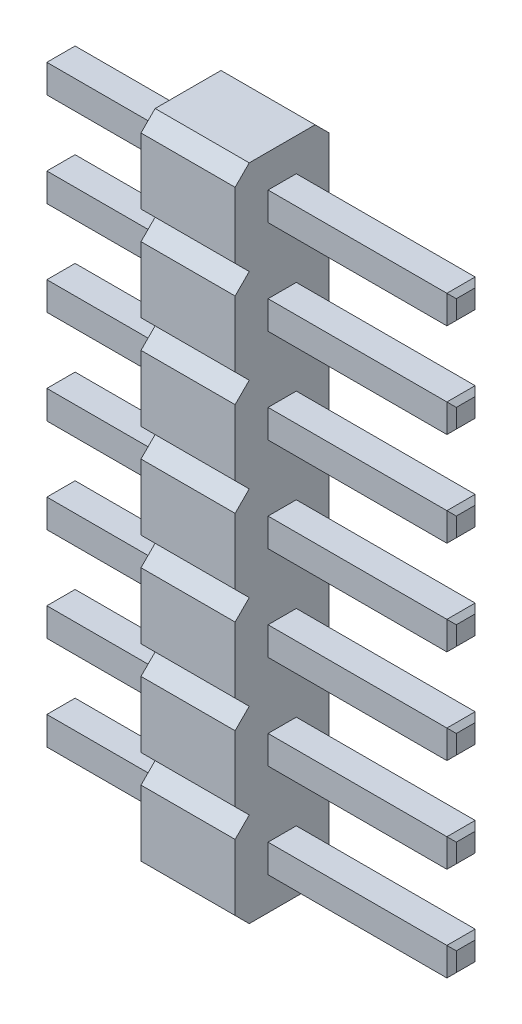
from build123d import *

# Parameters (mm, degrees)
PLASTIC_DEPTH   = 2
SKETCH2_W       = 8.7
SKETCH2_H       = 0.6
CONTACT_DEPTH   = 0.3
CHAMFER1_SIZE   = 0.1
LPATTERN1_COUNT = 7
LPATTERN1_PITCH = 2


with BuildPart() as part:
    # Sketch1 → Plastic (new body)
    with BuildSketch(Plane(origin=(0, 0, 0), x_dir=(0, 0, -1), z_dir=(1, 0, 0))):
        Polygon((-1.7, 1), (-0.3, 1), (0, 0.7), (0, -0.7), (-0.3, -1), (-1.7, -1), (-2, -0.7), (-2, 0.7), align=None)
    extrude(amount=PLASTIC_DEPTH)

    # Sketch2 → Contact (add, symmetric)
    with BuildSketch(Plane(origin=(0, 0, 0), x_dir=(1, 0, 0), z_dir=(0, 1, 0))):
        with Locations((1.55, -1)):
            Rectangle(SKETCH2_W, SKETCH2_H)
    extrude(amount=CONTACT_DEPTH, both=True)

    # Chamfer1
    chamfer1_edges = [part.edges().sort_by_distance(p)[0] for p in [
        (5.9, 0.3, 1),
        (5.9, 0, 1.3),
        (5.9, -0.3, 1),
        (5.9, 0, 0.7),
        (-2.8, -0.3, 1),
        (-2.8, 0, 0.7),
        (-2.8, 0.3, 1),
        (-2.8, 0, 1.3),
    ]]
    chamfer(chamfer1_edges, length=CHAMFER1_SIZE)

    # LPattern1: part ×7


with BuildPart() as part_1:
    add(part.part)
    with Locations(*[(0, i * LPATTERN1_PITCH, 0) for i in range(1, LPATTERN1_COUNT)]):
        add(part.part)


solid = part_1.part
